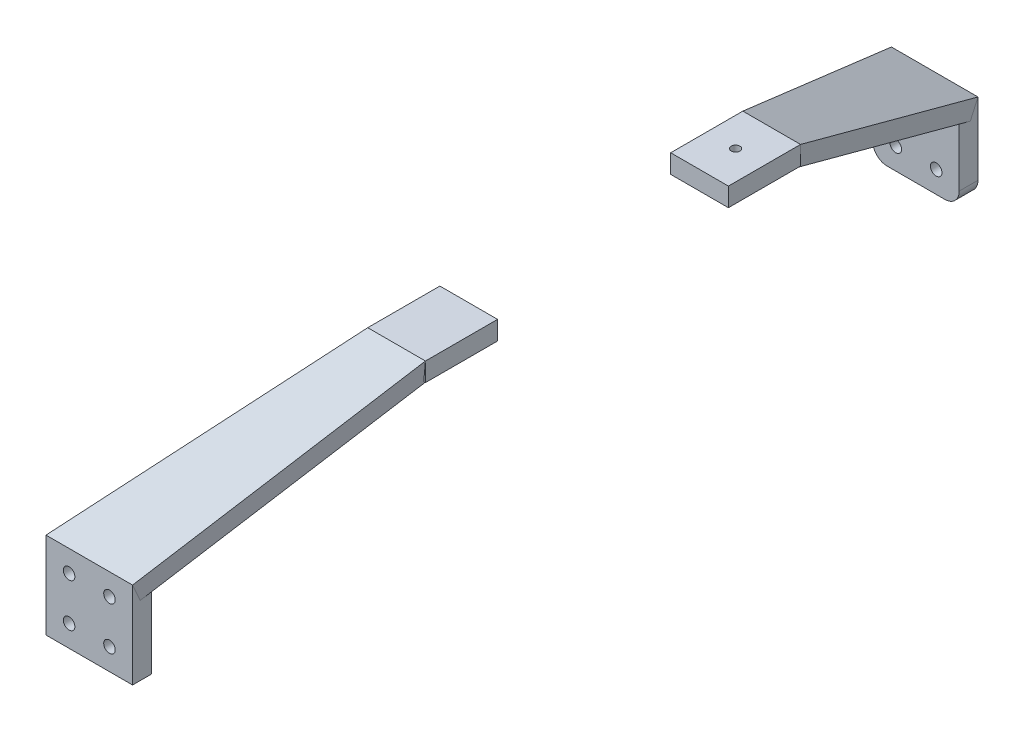
from build123d import *

# Parameters (mm, degrees)
SZKIC1_W                    = 60
SZKIC1_H                    = 60
DODANIE_WYCI_GNI_CIE1_DEPTH = 13
OTWORY_USTALAJ_CE_8_0MM1_D  = 8
DODANIE_WYCI_GNI_CIE3_DEPTH = 13
SZKIC5_7_W                  = 40
SZKIC5_7_H                  = 13
DODANIE_WYCI_GNI_CIE6_DEPTH = 50
ZAOKR_GLENIE3_R             = 10
ZAOKR_GLENIE4_R             = 10
SZKIC9_W                    = 3
SZKIC9_H                    = 133


with BuildPart() as part:
    # Szkic1 → Dodanie-wyciągnięcie1 (new body)
    with BuildSketch(Plane.XY):
        Rectangle(SZKIC1_W, SZKIC1_H)
    extrude(amount=DODANIE_WYCI_GNI_CIE1_DEPTH)

    # Otwory ustalające Ø8.0mm1 (through all)
    with Locations(Plane.XY.offset(13)):
        with Locations((14, 15), (-14, 15), (-14, -15), (14, -15)):
            Hole(OTWORY_USTALAJ_CE_8_0MM1_D / 2)

    # Szkic7 → Dodanie-wyciągnięcie3 (add)
    with BuildSketch(Plane(origin=(0, 29.837513324, 13.362812716), x_dir=(1, 0, 0), z_dir=(0, 0.9126534031310359, 0.40873434618751925))):
        Polygon((30, 0.397536145), (70, 178.997648127), (30, 178.997648127), (-30, 0.397536145), align=None)
    extrude(amount=-DODANIE_WYCI_GNI_CIE3_DEPTH)

    # Szkic5<7> → Dodanie-wyciągnięcie6 (add)
    with BuildSketch(Plane(origin=(0, 0, -150), x_dir=(-1, 0, 0), z_dir=(0, 0, -1))):
        with Locations((-50, 96.5)):
            Rectangle(SZKIC5_7_W, SZKIC5_7_H)
    extrude(amount=DODANIE_WYCI_GNI_CIE6_DEPTH)


with BuildPart() as body_2:
    # Lustro3: mirrored copy
    add(part.part.mirror(Plane(origin=(0, 0, -280), x_dir=(1, 0, 0), z_dir=(0, 0, -1))))

    # Zaokrąglenie3
    zaokr_glenie3_edges = [body_2.edges().sort_by_distance(p)[0] for p in [
        (30, -30, -566.5),
    ]]
    fillet(zaokr_glenie3_edges, radius=ZAOKR_GLENIE3_R)

    # Zaokrąglenie4
    zaokr_glenie4_edges = [body_2.edges().sort_by_distance(p)[0] for p in [
        (-30, -30, -566.5),
    ]]
    fillet(zaokr_glenie4_edges, radius=ZAOKR_GLENIE4_R)

    # Szkic9 → Otwory ustalające Ø6.0mm1 (revolve, cut)
    with BuildSketch(Plane(origin=(50, 103, -385), x_dir=(0, 0, 1), z_dir=(1, 0, 0))):
        with Locations((1.5, 66.5)):
            Rectangle(SZKIC9_W, SZKIC9_H)
    revolve(axis=Axis((50, 109.35, -385), (0, -1, 0)), mode=Mode.SUBTRACT)


solid = Compound([part.part, body_2.part])
